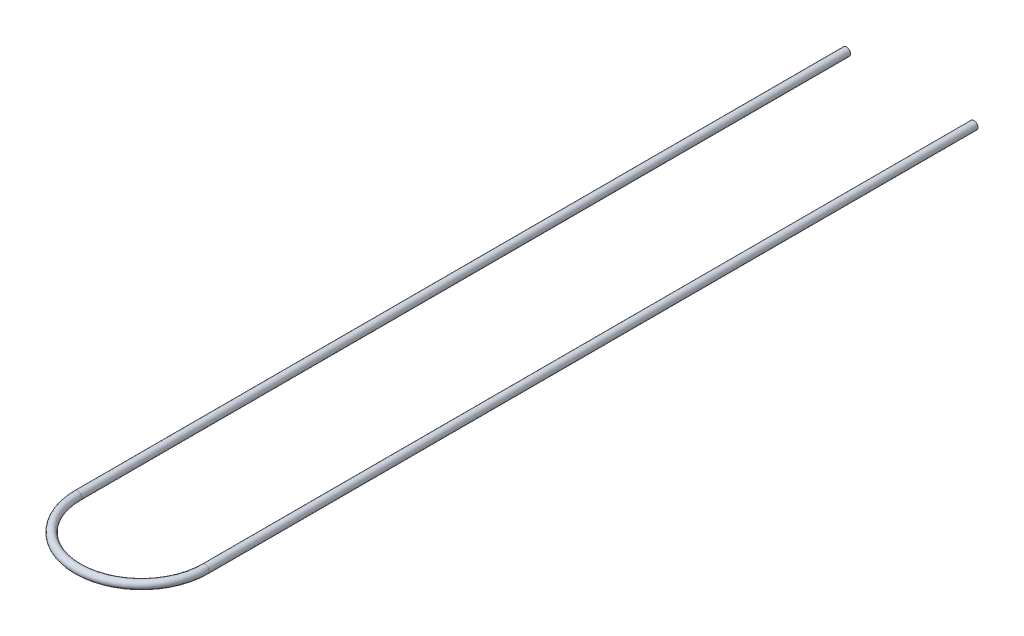
from build123d import *

# Parameters (mm, degrees)
SKETCH2_R   = 11.1
SKETCH2_R_2 = 9.95


with BuildPart() as part:
    # Sweep1: sweep along a path in Sketch1
    with BuildLine(Plane(origin=(0, 0, 0), x_dir=(1, 0, 0), z_dir=(0, 1, 0))) as sweep1_path:
        Line((314.77, -300), (314.77, -2440))
        ThreePointArc((314.77, -2440), (137.385, -2617.385), (-40, -2440))
        Line((-40, -2440), (-40, -300))
    # Sketch2 → Sweep1 (sweep)
    with BuildSketch(Plane(origin=(314.77, 0, 300), x_dir=(-1, 0, 0), z_dir=(0, 0, -1))):
        Circle(SKETCH2_R)
        Circle(SKETCH2_R_2, mode=Mode.SUBTRACT)
    sweep(path=sweep1_path.line)


solid = part.part
